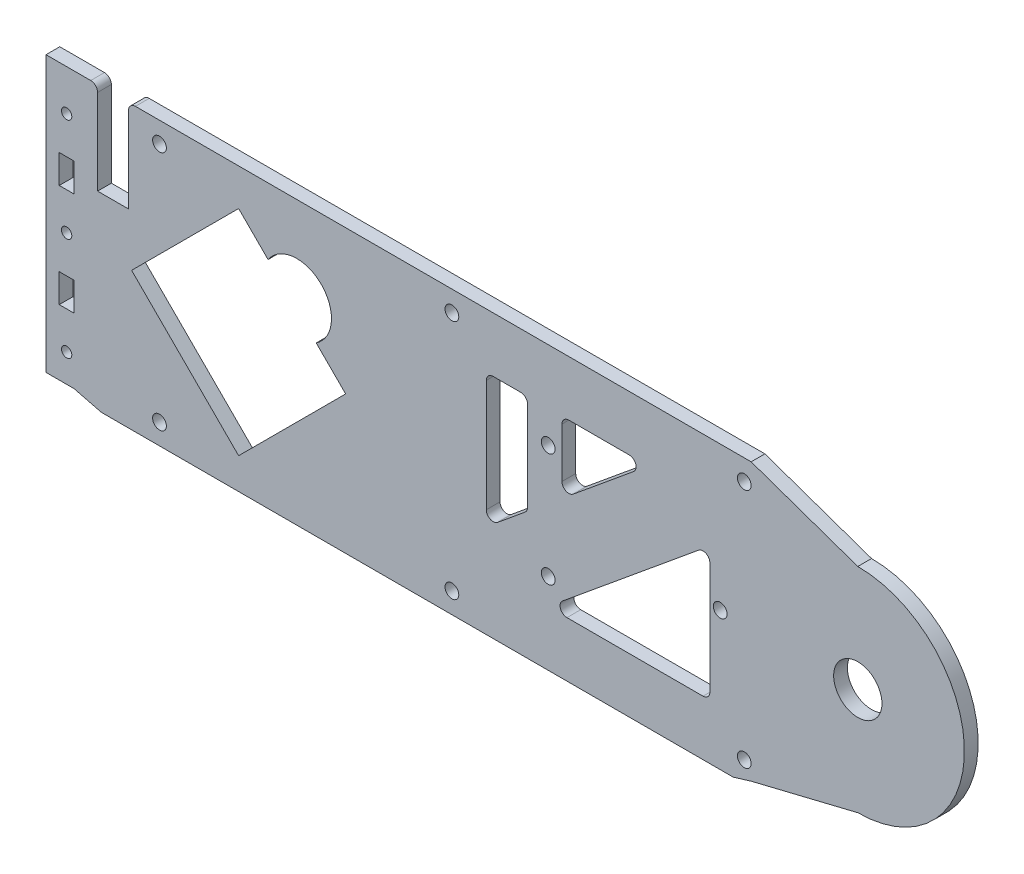
from build123d import *

# Parameters (mm, degrees)
SKETCH_1_R          = 1.5
SKETCH_1_R_2        = 7.02
SKETCH_1_W          = 4.3
SKETCH_1_H          = 8.3
EXTRUDE_1_DEPTH     = 4
CUT_EXTRUDE_1_DEPTH = 4
SKETCH_3_R          = 2
CUT_EXTRUDE_2_DEPTH = 4
SKETCH_4_W          = 10
SKETCH_4_H          = 47.093490756
EXTRUDE_2_DEPTH     = 4
SKETCH_7_R          = 2
CUT_EXTRUDE_3_DEPTH = 4
FILLET_1_R          = 2


with BuildPart() as part:
    # 草图1 → 凸台-拉伸1 (new body)
    with BuildSketch(Plane.XY):
        with BuildLine():
            Line((230.542857143, -31.145714286), (199.556073527, -38.70591431))
            Line((199.556073527, -38.70591431), (174.542857143, -46.295714286))
            Line((174.542857143, -46.295714286), (34.542857143, -46.295714286))
            Line((34.542857143, -46.295714286), (2.692857143, -38.295714286))
            Line((2.692857143, -38.295714286), (-5.457142857, -38.295714286))
            Line((-5.457142857, -38.295714286), (-5.457142857, 41.704285714))
            Line((-5.457142857, 41.704285714), (9.542857143, 41.704285714))
            Line((9.542857143, 41.704285714), (9.542857143, 14.854285714))
            Line((9.542857143, 14.854285714), (18.542857143, 14.854285714))
            Line((18.542857143, 14.854285714), (18.542857143, 41.704285714))
            Line((18.542857143, 41.704285714), (199.542857143, 41.704285714))
            Line((199.542857143, 41.704285714), (230.542857143, 30.854285714))
            ThreePointArc((230.542857143, 30.854285714), (261.542857143, -0.145714286), (230.542857143, -31.145714286))
        make_face()
        with Locations((0.542857143, 29.854285714)):
            Circle(SKETCH_1_R, mode=Mode.SUBTRACT)
        with Locations((0.542857143, -0.145714286)):
            Circle(SKETCH_1_R, mode=Mode.SUBTRACT)
        with Locations((0.542857143, -30.145714286)):
            Circle(SKETCH_1_R, mode=Mode.SUBTRACT)
        with Locations((230.542857143, -0.145714286)):
            Circle(SKETCH_1_R_2, mode=Mode.SUBTRACT)
        with Locations((0.542857143, 14.854285714)):
            Rectangle(SKETCH_1_W, SKETCH_1_H, mode=Mode.SUBTRACT)
        with Locations((0.542857143, -15.145714286)):
            Rectangle(SKETCH_1_W, SKETCH_1_H, mode=Mode.SUBTRACT)
    extrude(amount=EXTRUDE_1_DEPTH)

    # 草图2 → 切除-拉伸1 (cut)
    with BuildSketch(Plane.XY.offset(4)):
        with BuildLine():
            Line((59.099206329, 22.4106349), (50.542857143, 30.966984086))
            Line((50.542857143, 30.966984086), (19.430158771, -0.145714286))
            Line((19.430158771, -0.145714286), (50.542857143, -31.258412658))
            Line((50.542857143, -31.258412658), (81.655555515, -0.145714286))
            Line((81.655555515, -0.145714286), (73.099206329, 8.4106349))
            ThreePointArc((73.099206329, 8.4106349), (74.584487703, 23.895916275), (59.099206329, 22.4106349))
        make_face()
    extrude(amount=-CUT_EXTRUDE_1_DEPTH, mode=Mode.SUBTRACT)

    # 草图3 → 切除-拉伸2 (cut)
    with BuildSketch(Plane.XY.offset(4)):
        with Locations((27.542857143, 35.704285714)):
            Circle(SKETCH_3_R)
        with Locations((112.542857143, 35.704285714)):
            Circle(SKETCH_3_R)
        with Locations((197.542857143, 35.704285714)):
            Circle(SKETCH_3_R)
        with Locations((112.542857143, -34.295714286)):
            Circle(SKETCH_3_R)
        with Locations((197.542857143, -34.295714286)):
            Circle(SKETCH_3_R)
        with Locations((27.542857143, -34.295714286)):
            Circle(SKETCH_3_R)
        Polygon((187.542857143, -24.295714286), (140.41622539, -24.295714286), (187.542857143, 14.51445304), align=None)
        Polygon((122.542857143, 25.704285714), (169.669488896, 25.704285714), (122.542857143, -13.105881612), align=None)
    extrude(amount=-CUT_EXTRUDE_2_DEPTH, mode=Mode.SUBTRACT)

    # 草图4 → 凸台-拉伸2 (add)
    with BuildSketch(Plane.XY.offset(4)):
        with Locations((139.542857143, 15.704285714)):
            Rectangle(SKETCH_4_W, SKETCH_4_H)
    extrude(amount=-EXTRUDE_2_DEPTH)

    # 草图7 → 切除-拉伸3 (cut)
    with BuildSketch(Plane.XY.offset(4)):
        with Locations((190.542857143, -0.145714286)):
            Circle(SKETCH_7_R)
        with Locations((140.542857143, 16.354285714)):
            Circle(SKETCH_7_R)
        with Locations(Location((140.542857143, -16.645714286, 0), (0, 0, 180))):
            Circle(SKETCH_7_R)
        Polygon((10.655357143, -40.295714286), (194.316671838, -40.295714286), (206.19710926, -67.618852766), (10.655357143, -65.874099546), align=None)
    extrude(amount=-CUT_EXTRUDE_3_DEPTH, mode=Mode.SUBTRACT)

    # 圆角1
    fillet_1_edges = [part.edges().sort_by_distance(p)[0] for p in [
        (187.542857143, 14.51445304, 2),
        (187.542857143, -24.295714286, 2),
        (140.41622539, -24.295714286, 2),
        (122.542857143, -13.105881612, 2),
        (122.542857143, 25.704285714, 2),
        (169.669488896, 25.704285714, 2),
        (134.542857143, -3.223528671, 2),
        (144.542857143, 5.011765447, 2),
        (144.542857143, 25.704285714, 2),
        (134.542857143, 25.704285714, 2),
        (9.542857143, 41.704285714, 2),
        (18.542857143, 41.704285714, 2),
    ]]
    fillet(fillet_1_edges, radius=FILLET_1_R)


solid = part.part
